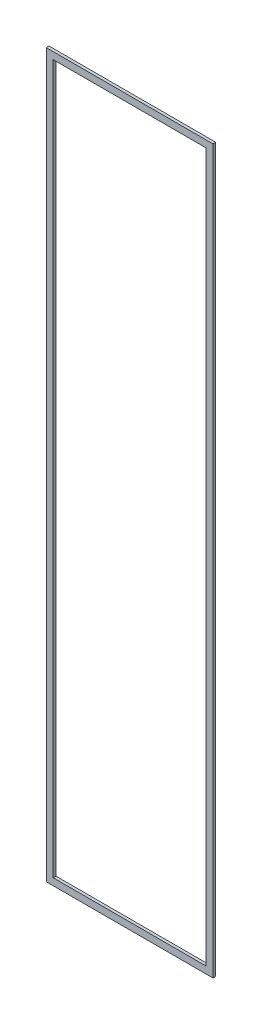
from build123d import *

# Parameters (mm, degrees)
SKETCH1_W           = 600
SKETCH1_H           = 2600
SKETCH1_W_2         = 550
SKETCH1_H_2         = 2550
BOSS_EXTRUDE1_DEPTH = 10


with BuildPart() as part:
    # Sketch1 → Boss-Extrude1 (new body)
    with BuildSketch(Plane.XY):
        Rectangle(SKETCH1_W, SKETCH1_H)
        Rectangle(SKETCH1_W_2, SKETCH1_H_2, mode=Mode.SUBTRACT)
    extrude(amount=BOSS_EXTRUDE1_DEPTH)


solid = part.part
